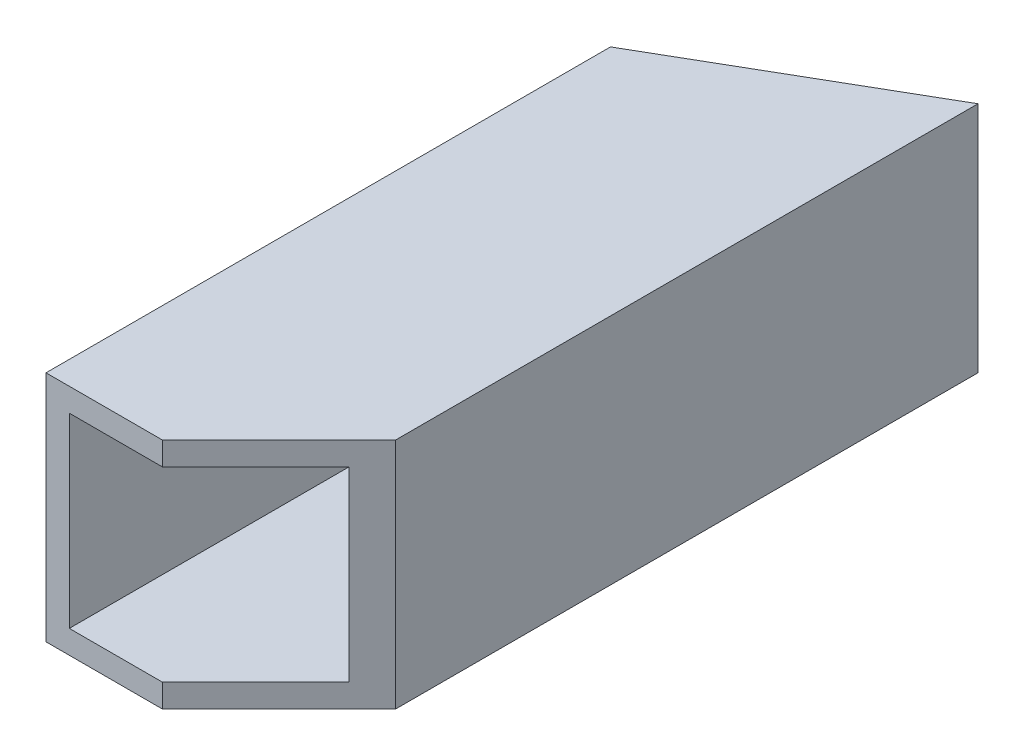
from build123d import *

# Parameters (mm, degrees)
SKETCH2_W           = 50
SKETCH2_H           = 50
SKETCH2_W_2         = 40
SKETCH2_H_2         = 40
BOSS_EXTRUDE1_DEPTH = 150
CUT_EXTRUDE1_DEPTH  = 161.078105936
CUT_EXTRUDE2_DEPTH  = 161.078105936


with BuildPart() as part:
    # Sketch2 → Boss-Extrude1 (new body)
    with BuildSketch(Plane(origin=(0, 0, 0), x_dir=(1, 0, 0), z_dir=(0, 0, -1))):
        Rectangle(SKETCH2_W, SKETCH2_H)
        Rectangle(SKETCH2_W_2, SKETCH2_H_2, mode=Mode.SUBTRACT)
    extrude(amount=-BOSS_EXTRUDE1_DEPTH)

    # Sketch3 → Cut-Extrude1 (cut, through all)
    with BuildSketch(Plane.XZ.offset(25)):
        Polygon((0, 150), (25, 125), (25, 150), align=None)
    extrude(amount=-CUT_EXTRUDE1_DEPTH, mode=Mode.SUBTRACT)

    # Sketch4 → Cut-Extrude2 (cut, through all)
    with BuildSketch(Plane.XZ.offset(25)):
        Polygon((25, 0), (-25, 28.867513459), (-25, 0), align=None)
    extrude(amount=-CUT_EXTRUDE2_DEPTH, mode=Mode.SUBTRACT)


solid = part.part
